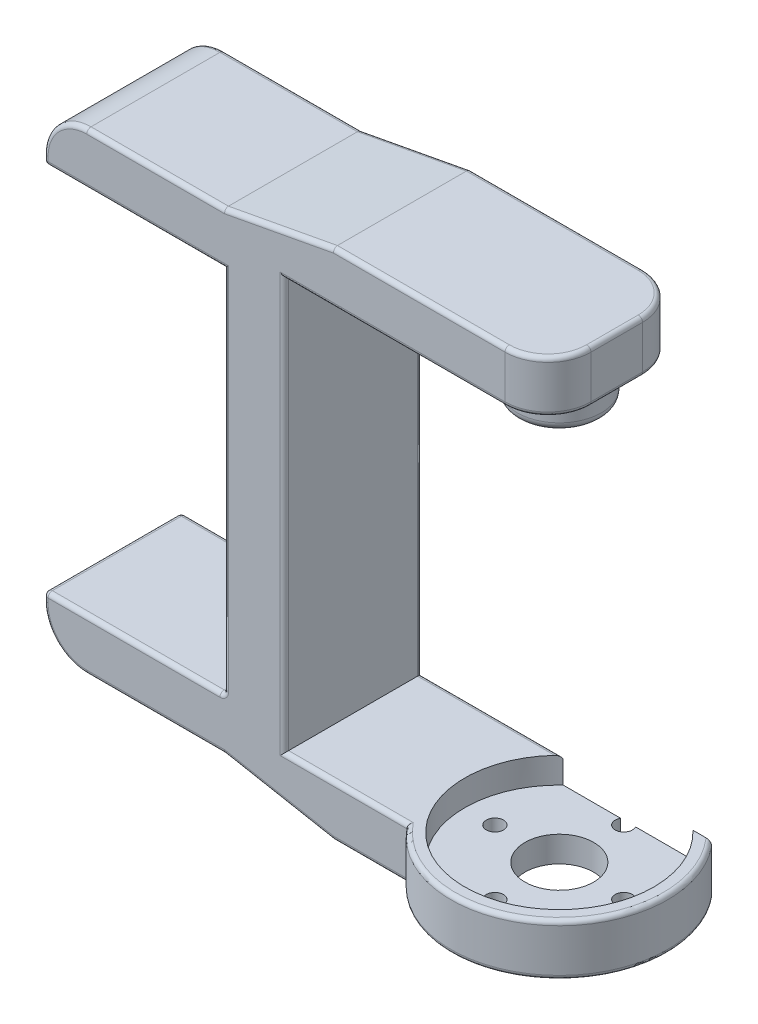
from build123d import *

# Parameters (mm, degrees)
BOSS_EXTRUDE1_DEPTH = 16
SKETCH3_R           = 4
SKETCH3_R_2         = 1
BOSS_EXTRUDE2_DEPTH = 6
SKETCH3_3_R         = 1
CUT_EXTRUDE1_DEPTH  = 3
SKETCH3_4_R         = 4
SKETCH3_4_R_2       = 1
CUT_EXTRUDE2_DEPTH  = 6.5
SKETCH4_R           = 4.9
SKETCH4_R_2         = 1
BOSS_EXTRUDE3_DEPTH = 4
SKETCH4_3_R         = 1
BOSS_EXTRUDE4_DEPTH = 5
FILLET1_R           = 0.8
FILLET2_R           = 1
FILLET3_R           = 5
FILLET4_R           = 5
FILLET5_R           = 0.5


with BuildPart() as part:
    # Sketch1 → Boss-Extrude1 (new body)
    with BuildSketch(Plane.XY):
        Polygon((0, 49), (21, 49), (33.679866004, 51.372972423), (58.679866004, 51.372972423), (58.679866004, 45.372972423), (33.679866004, 45.372972423), (28, 45.372972423), (28, 43), (28, 0), (28, -2.372972423), (33.679866004, -2.372972423), (58.679866004, -2.372972423), (58.679866004, -8.372972423), (33.679866004, -8.372972423), (21, -6), (0, -6), (0, 0), (21, 0), (21, 43), (0, 43), align=None)
    extrude(amount=BOSS_EXTRUDE1_DEPTH)

    # Sketch3 → Boss-Extrude2 (add)
    with BuildSketch(Plane(origin=(0, -2.372972423, 0), x_dir=(1, 0, 0), z_dir=(0, 1, 0))):
        with BuildLine():
            Line((58.679866004, 0), (42.265525181, 0))
            ThreePointArc((42.265525181, 0), (52, -20.6), (61.734474819, 0))
            Line((61.734474819, 0), (58.679866004, 0))
        make_face()
        with Locations((52, -8)):
            Circle(SKETCH3_R, mode=Mode.SUBTRACT)
        with Locations((44.5, -8)):
            Circle(SKETCH3_R_2, mode=Mode.SUBTRACT)
        with Locations((59.5, -8)):
            Circle(SKETCH3_R_2, mode=Mode.SUBTRACT)
        with Locations((52, -15.5)):
            Circle(SKETCH3_R_2, mode=Mode.SUBTRACT)
    extrude(amount=-BOSS_EXTRUDE2_DEPTH)

    # Sketch3<3> → Cut-Extrude1 (cut)
    with BuildSketch(Plane(origin=(0, -2.372972423, 0), x_dir=(1, 0, 0), z_dir=(0, 1, 0))):
        with BuildLine():
            Line((59.549834435, 0), (58.679866004, 0))
            Line((58.679866004, 0), (52.866025404, 0))
            ThreePointArc((52.866025404, 0), (52, -1.5), (51.133974596, 0))
            Line((51.133974596, 0), (44.450165565, 0))
            ThreePointArc((44.450165565, 0), (41.899302529, -3.643865176), (41, -8))
            ThreePointArc((41, -8), (56.356134824, -18.100697471), (59.549834435, 0))
        make_face()
        with Locations((52, -15.5)):
            Circle(SKETCH3_3_R, mode=Mode.SUBTRACT)
        with BuildLine():
            ThreePointArc((45.5, -8), (44.5, -9), (43.5, -8))
            ThreePointArc((43.5, -8), (44.5, -7), (45.5, -8))
        make_face(mode=Mode.SUBTRACT)
        with BuildLine():
            ThreePointArc((56, -8), (52, -12), (48, -8))
            ThreePointArc((48, -8), (52, -4), (56, -8))
        make_face(mode=Mode.SUBTRACT)
        with Locations((59.5, -8)):
            Circle(SKETCH3_3_R, mode=Mode.SUBTRACT)
    extrude(amount=-CUT_EXTRUDE1_DEPTH, mode=Mode.SUBTRACT)

    # Sketch3<4> → Cut-Extrude2 (cut, symmetric)
    with BuildSketch(Plane(origin=(0, -2.372972423, 0), x_dir=(1, 0, 0), z_dir=(0, 1, 0))):
        with Locations(Location((52, -8, 0), (0, 0, 270))):
            Circle(SKETCH3_4_R)
        with Locations(Location((44.5, -8, 0), (0, 0, 270))):
            Circle(SKETCH3_4_R_2)
        with BuildLine():
            ThreePointArc((51.133974596, 0), (52, -1.5), (52.866025404, 0))
            Line((52.866025404, 0), (51.133974596, 0))
        make_face()
        with BuildLine():
            Line((58.679866004, -8.572171503), (58.679866004, -7.427828497))
            ThreePointArc((58.679866004, -7.427828497), (58.5, -8), (58.679866004, -8.572171503))
        make_face()
        with BuildLine():
            ThreePointArc((52.866025404, -16), (52, -14.5), (51.133974596, -16))
            Line((51.133974596, -16), (52.866025404, -16))
        make_face()
    extrude(amount=CUT_EXTRUDE2_DEPTH, both=True, mode=Mode.SUBTRACT)

    # Sketch4 → Boss-Extrude3 (add)
    with BuildSketch(Plane.XZ.offset(-45.372972423)):
        with Locations(Location((52, 8, 0), (0, 0, 90))):
            Circle(SKETCH4_R)
        with Locations(Location((52, 8, 0), (0, 0, 270))):
            Circle(SKETCH4_R_2, mode=Mode.SUBTRACT)
    extrude(amount=BOSS_EXTRUDE3_DEPTH)

    # Sketch4<3> → Boss-Extrude4 (add)
    with BuildSketch(Plane.XZ.offset(-45.372972423)):
        with Locations(Location((52, 8, 0), (0, 0, 270))):
            Circle(SKETCH4_3_R)
    extrude(amount=BOSS_EXTRUDE4_DEPTH)

    # Fillet1
    fillet1_edges = [part.edges().sort_by_distance(p)[0] for p in [
        (52, 40.372972423, 9),
    ]]
    fillet(fillet1_edges, radius=FILLET1_R)

    # Fillet2
    fillet2_edges = [part.edges().sort_by_distance(p)[0] for p in [
        (52, 41.372972423, 3.1),
    ]]
    fillet(fillet2_edges, radius=FILLET2_R)

    # Fillet3
    fillet3_edges = [part.edges().sort_by_distance(p)[0] for p in [
        (58.679866004, 48.372972423, 0),
        (58.679866004, 48.372972423, 16),
    ]]
    fillet(fillet3_edges, radius=FILLET3_R)

    # Fillet4
    fillet4_edges = [part.edges().sort_by_distance(p)[0] for p in [
        (0, 49, 8),
        (0, -6, 8),
    ]]
    fillet(fillet4_edges, radius=FILLET4_R)

    # Fillet5
    fillet5_edges = [part.edges().sort_by_distance(p)[0] for p in [
        (43.679866004, 51.372972423, 16),
        (57.21539991, 51.372972423, 14.535533906),
        (58.679866004, 51.372972423, 8),
        (57.21539991, 51.372972423, 1.464466094),
        (0, 43.5, 16),
        (1.464466094, 47.535533906, 16),
        (0, 43.5, 0),
        (1.464466094, 47.535533906, 0),
        (0, -0.5, 16),
        (1.464466094, -4.535533906, 16),
        (0, -0.5, 0),
        (1.464466094, -4.535533906, 0),
        (40.839933002, 45.372972423, 16),
        (57.21539991, 45.372972423, 14.535533906),
        (58.679866004, 45.372972423, 8),
        (57.21539991, 45.372972423, 1.464466094),
        (43.679866004, 51.372972423, 0),
        (27.339933002, 50.186486211, 16),
        (13, 49, 16),
        (13, 49, 0),
        (27.339933002, 50.186486211, 0),
        (13, -6, 16),
        (13, -6, 0),
        (27.339933002, -7.186486211, 0),
        (27.339933002, -7.186486211, 16),
        (37.972695593, -8.372972423, 16),
        (60, -8.372972423, 17.734474819),
        (60, -2.372972423, 17.734474819),
        (35.132762591, -2.372972423, 16),
        (28, 21.5, 16),
        (40.839933002, 45.372972423, 0),
        (28, 21.5, 0),
        (36.225082782, -2.372972423, 0),
        (0, 43, 8),
        (0, 0, 8),
        (21, 0, 8),
        (10.5, 0, 16),
        (21, 21.5, 16),
        (10.5, 43, 16),
        (10.5, 43, 0),
        (21, 21.5, 0),
        (10.5, 0, 0),
    ]]
    fillet(fillet5_edges, radius=FILLET5_R)


solid = part.part
